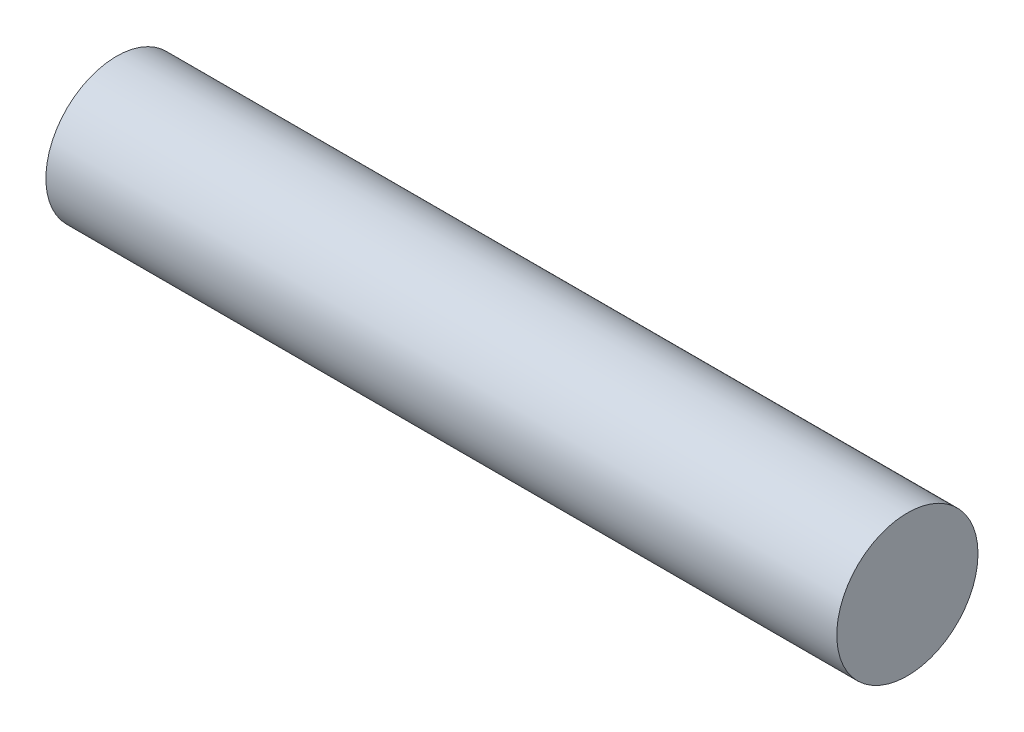
from build123d import *

# Parameters (mm, degrees)
BOSS_EXTRUDE1_DEPTH      = 20.32
BOSS_EXTRUDE1_DEPTH_BACK = 15.24
SKETCH1_R                = 3.175


with BuildPart() as part:
    # Sketch1 → Boss-Extrude1 (new, two sides: drawn at the far end of the back side and taken through both)
    with BuildSketch(Plane(origin=(0, 0, 0), x_dir=(0, 0, -1), z_dir=(1, 0, 0)).offset(-BOSS_EXTRUDE1_DEPTH_BACK)):
        Circle(SKETCH1_R)
    extrude(amount=BOSS_EXTRUDE1_DEPTH + BOSS_EXTRUDE1_DEPTH_BACK)


solid = part.part
